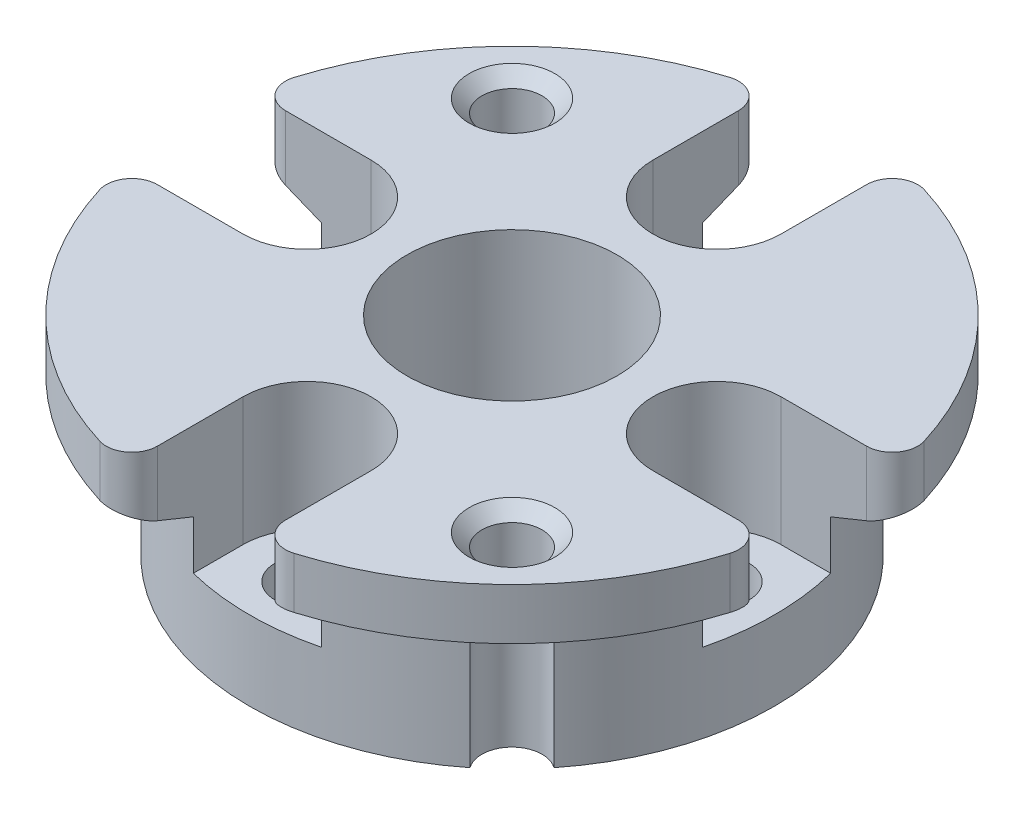
from build123d import *

# Parameters (mm, degrees)
SKETCH3_R          = 1.25
CUT_EXTRUDE1_DEPTH = 20.917878903
CUT_EXTRUDE2_DEPTH = 5
SKETCH4_R          = 1.175
CUT_EXTRUDE3_DEPTH = 20.601579018
CHAMFER1_SIZE      = 0.5
FILLET1_R          = 1


with BuildPart() as part:
    # Sketch2 → Revolve2 (revolve)
    with BuildSketch(Plane.XY):
        Polygon((4.1, 0), (10.25, 0), (10.25, 5), (12.87, 6.09), (12.87, 8.09), (4.1, 8.09), align=None)
    revolve(axis=Axis((0, 8.09, 0), (0, -1, 0)))

    # Sketch3 → Cut-Extrude1 (cut, through all)
    with BuildSketch(Plane.XZ):
        with Locations(Location((0, 8, 0), (0, 0, 270))):
            Circle(SKETCH3_R)
        with Locations(Location((8, 0, 0), (0, 0, 270))):
            Circle(SKETCH3_R)
        with Locations(Location((0, -8, 0), (0, 0, 270))):
            Circle(SKETCH3_R)
        with Locations(Location((-8, 0, 0), (0, 0, 270))):
            Circle(SKETCH3_R)
    extrude(amount=-CUT_EXTRUDE1_DEPTH, mode=Mode.SUBTRACT)

    # Sketch5 → Cut-Extrude2 (cut)
    with BuildSketch(Plane(origin=(0, 8.09, 0), x_dir=(1, 0, 0), z_dir=(0, 1, 0))):
        with BuildLine():
            Line((-2.5, -8), (-2.5, -14))
            Line((-2.5, -14), (2.5, -14))
            Line((2.5, -14), (2.5, -8))
            ThreePointArc((2.5, -8), (0, -5.5), (-2.5, -8))
        make_face()
        with BuildLine():
            Line((-8, 2.5), (-14, 2.5))
            Line((-14, 2.5), (-14, -2.5))
            Line((-14, -2.5), (-8, -2.5))
            ThreePointArc((-8, -2.5), (-5.5, 0), (-8, 2.5))
        make_face()
        with BuildLine():
            Line((2.5, 8), (2.5, 14))
            Line((2.5, 14), (-2.5, 14))
            Line((-2.5, 14), (-2.5, 8))
            ThreePointArc((-2.5, 8), (0, 5.5), (2.5, 8))
        make_face()
        with BuildLine():
            Line((8, -2.5), (14, -2.5))
            Line((14, -2.5), (14, 2.5))
            Line((14, 2.5), (8, 2.5))
            ThreePointArc((8, 2.5), (5.5, 0), (8, -2.5))
        make_face()
    extrude(amount=-CUT_EXTRUDE2_DEPTH, mode=Mode.SUBTRACT)

    # Sketch4 → Cut-Extrude3 (cut, through all)
    with BuildSketch(Plane(origin=(0, 8.09, 0), x_dir=(1, 0, 0), z_dir=(0, 1, 0))):
        with Locations(Location((-7.336232855, 7.336232855, 0), (0, 0, 270))):
            Circle(SKETCH4_R)
        with Locations(Location((7.336232855, -7.336232855, 0), (0, 0, 270))):
            Circle(SKETCH4_R)
    extrude(amount=-CUT_EXTRUDE3_DEPTH, mode=Mode.SUBTRACT)

    # Chamfer1
    chamfer1_edges = [part.edges().sort_by_distance(p)[0] for p in [
        (7.336232855, 8.09, 6.161232855),
        (-7.336232855, 8.09, -8.511232855),
    ]]
    chamfer(chamfer1_edges, length=CHAMFER1_SIZE)

    # Fillet1
    fillet1_edges = [part.edges().sort_by_distance(p)[0] for p in [
        (-2.5, 7.09, -12.624852474),
        (2.5, 7.09, -12.624852474),
        (-12.624852474, 7.09, 2.5),
        (-12.624852474, 7.09, -2.5),
        (12.624852474, 7.09, -2.5),
        (12.624852474, 7.09, 2.5),
        (2.5, 7.09, 12.624852474),
        (-2.5, 7.09, 12.624852474),
    ]]
    fillet(fillet1_edges, radius=FILLET1_R)


solid = part.part
